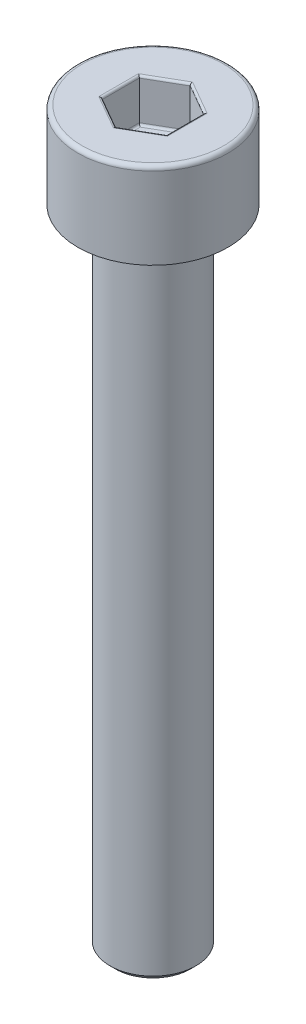
from build123d import *

# Parameters (mm, degrees)
CHAMFER1_SIZE      = 0.25
FILLET1_R          = 0.2
CUT_EXTRUDE1_DEPTH = 2
FILLET2_R          = 0.1


with BuildPart() as part:
    # Sketch1 → Revolve1 (revolve)
    with BuildSketch(Plane.XY, mode=Mode.PRIVATE) as revolve1_sk:
        Polygon((0, -34), (-2, -34), (-2, -4), (-3.5, -4), (-3.5, 0), (0, 0), align=None)
    revolve(revolve1_sk.sketch.rotate(Axis((0, 0, 0), (0, -1, 0)), 270), axis=Axis((0, 0, 0), (0, -1, 0)))

    # Chamfer1
    chamfer1_edges = [part.edges().sort_by_distance(p)[0] for p in [
        (0, -4, -2),
        (0, -34, -2),
    ]]
    chamfer(chamfer1_edges, length=CHAMFER1_SIZE)

    # Fillet1
    fillet1_edges = [part.edges().sort_by_distance(p)[0] for p in [
        (0, 0, -3.5),
    ]]
    fillet(fillet1_edges, radius=FILLET1_R)

    # Sketch2 → Cut-Extrude1 (cut)
    with BuildSketch(Plane(origin=(0, 0, 0), x_dir=(1, 0, 0), z_dir=(0, 1, 0))):
        Polygon((0, 1.732050808), (-1.5, 0.866025404), (-1.5, -0.866025404), (0, -1.732050808), (1.5, -0.866025404), (1.5, 0.866025404), align=None)
    extrude(amount=-CUT_EXTRUDE1_DEPTH, mode=Mode.SUBTRACT)

    # Fillet2
    fillet2_edges = [part.edges().sort_by_distance(p)[0] for p in [
        (0.75, -2, -1.299038106),
        (1.5, -2, 0),
        (0.75, -2, 1.299038106),
        (-0.75, -2, 1.299038106),
        (-1.5, -2, 0),
        (-0.75, -2, -1.299038106),
        (0.75, 0, -1.299038106),
        (-0.75, 0, -1.299038106),
        (-1.5, 0, 0),
        (-0.75, 0, 1.299038106),
        (0.75, 0, 1.299038106),
        (1.5, 0, 0),
    ]]
    fillet(fillet2_edges, radius=FILLET2_R)


solid = part.part
